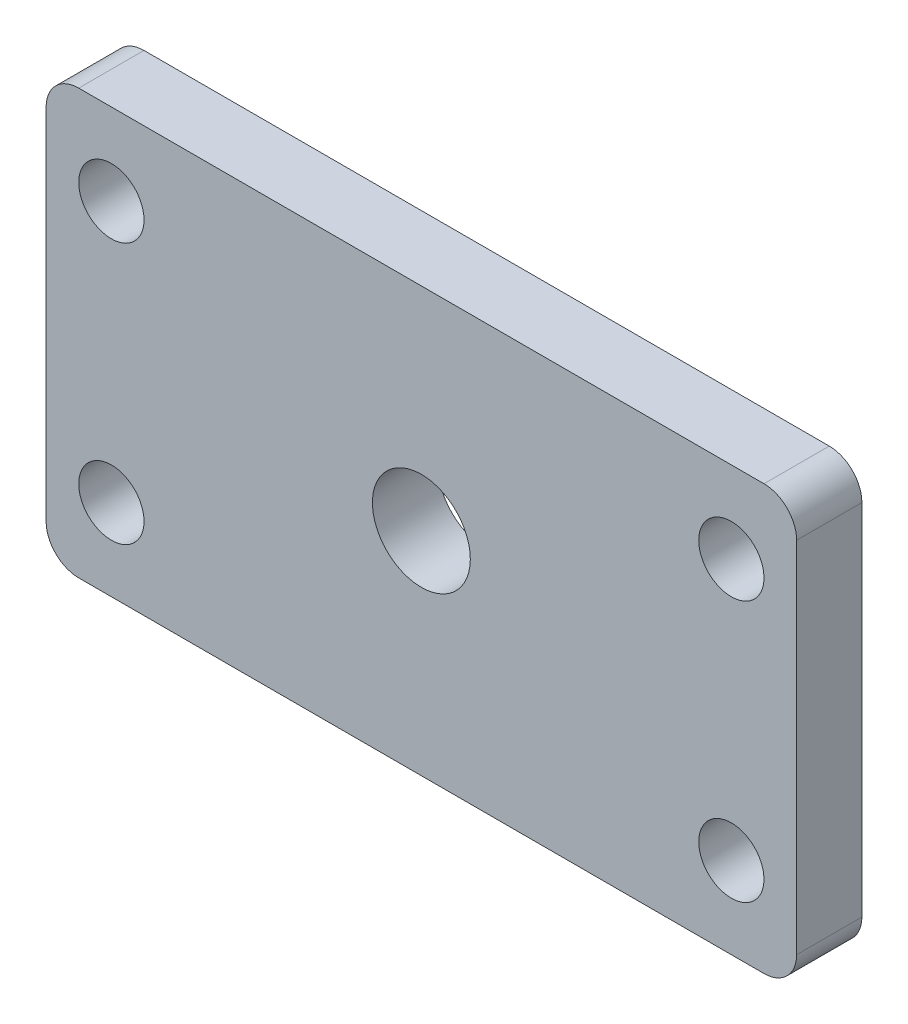
from build123d import *

# Parameters (mm, degrees)
SKETCH_1_W      = 23
SKETCH_1_H      = 13
SKETCH_1_R      = 1
SKETCH_1_R_2    = 1.5
EXTRUDE_1_DEPTH = 2
FILLET_1_R      = 1


with BuildPart() as part:
    # 草图1 → 凸台-拉伸1 (new body)
    with BuildSketch(Plane.XY):
        Rectangle(SKETCH_1_W, SKETCH_1_H)
        with Locations((-9.5, 4)):
            Circle(SKETCH_1_R, mode=Mode.SUBTRACT)
        with Locations((-9.5, -4)):
            Circle(SKETCH_1_R, mode=Mode.SUBTRACT)
        with Locations(Location((9.5, -4, 0), (0, 0, 180))):
            Circle(SKETCH_1_R, mode=Mode.SUBTRACT)
        with Locations(Location((9.5, 4, 0), (0, 0, 180))):
            Circle(SKETCH_1_R, mode=Mode.SUBTRACT)
        Circle(SKETCH_1_R_2, mode=Mode.SUBTRACT)
    extrude(amount=EXTRUDE_1_DEPTH)

    # 圆角1
    fillet_1_edges = [part.edges().sort_by_distance(p)[0] for p in [
        (11.5, -6.5, 1),
        (-11.5, -6.5, 1),
        (-11.5, 6.5, 1),
        (11.5, 6.5, 1),
    ]]
    fillet(fillet_1_edges, radius=FILLET_1_R)


solid = part.part
